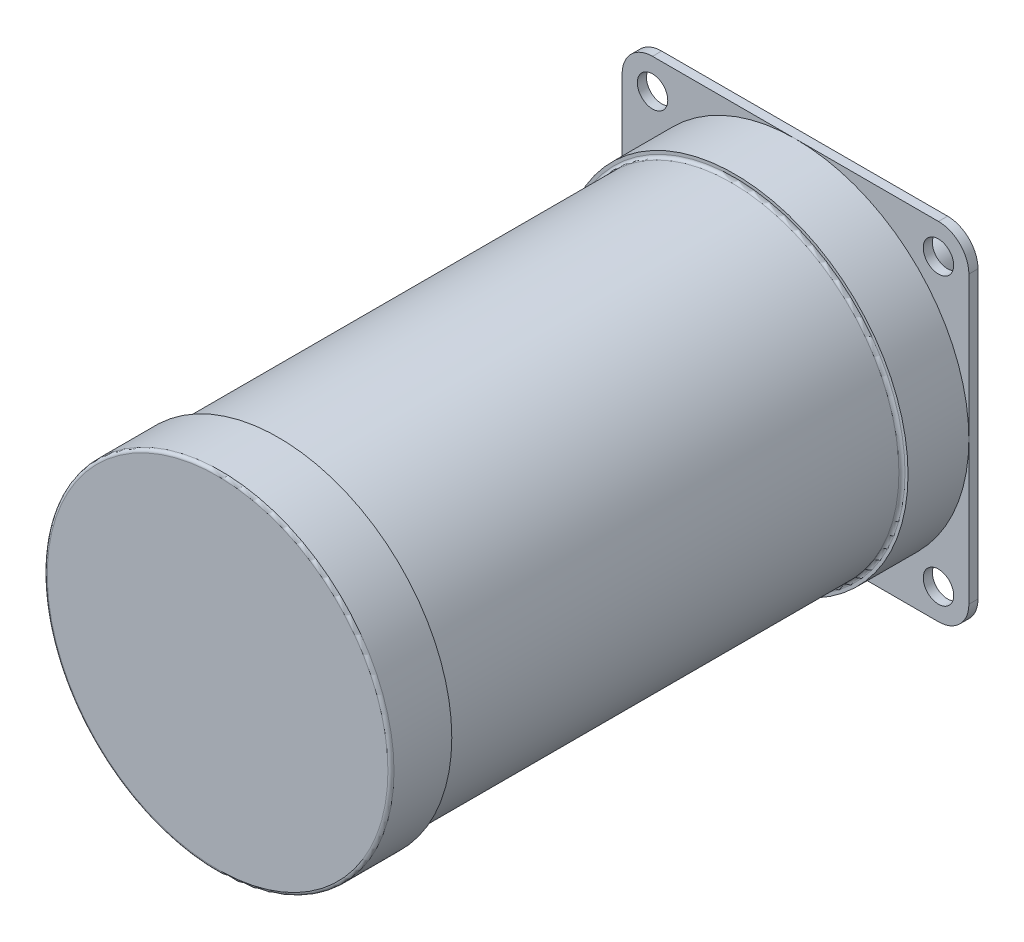
from build123d import *

# Parameters (mm, degrees)
SKETCH1_W           = 57
SKETCH1_H           = 57
BOSS_EXTRUDE1_DEPTH = 1.5
SKETCH2_R           = 28.5
BOSS_EXTRUDE2_DEPTH = 10
SKETCH3_R           = 27.5
BOSS_EXTRUDE3_DEPTH = 75
SKETCH4_R           = 28.5
BOSS_EXTRUDE4_DEPTH = 10
CUT_EXTRUDE1_REACH  = 127.739
SKETCH5_R           = 2.5
SKETCH6_R           = 19
BOSS_EXTRUDE5_DEPTH = 1.5
SKETCH7_R           = 4
BOSS_EXTRUDE6_DEPTH = 20
FILLET1_R           = 5
FILLET2_R           = 0.5


with BuildPart() as part:
    # Sketch1 → Boss-Extrude1 (new body)
    with BuildSketch(Plane.XY):
        with Locations((28.5, 28.5)):
            Rectangle(SKETCH1_W, SKETCH1_H)
    extrude(amount=BOSS_EXTRUDE1_DEPTH)

    # Sketch2 → Boss-Extrude2 (add)
    with BuildSketch(Plane.XY.offset(1.5)):
        with Locations((28.5, 28.5)):
            Circle(SKETCH2_R)
    extrude(amount=BOSS_EXTRUDE2_DEPTH)

    # Sketch3 → Boss-Extrude3 (add)
    with BuildSketch(Plane.XY.offset(11.5)):
        with Locations((28.5, 28.5)):
            Circle(SKETCH3_R)
    extrude(amount=BOSS_EXTRUDE3_DEPTH)

    # Sketch4 → Boss-Extrude4 (add)
    with BuildSketch(Plane.XY.offset(86.5)):
        with Locations((28.5, 28.5)):
            Circle(SKETCH4_R)
    extrude(amount=BOSS_EXTRUDE4_DEPTH)

    # Sketch5 → Cut-Extrude1 (cut, up to next)
    with BuildSketch(Plane(origin=(0, 0, 0), x_dir=(-1, 0, 0), z_dir=(0, 0, -1)), mode=Mode.PRIVATE) as cut_extrude1_sk1:
        with Locations((-52, 52)):
            Circle(SKETCH5_R)
    cut_extrude1_tool1 = extrude(cut_extrude1_sk1.sketch, amount=-CUT_EXTRUDE1_REACH, mode=Mode.PRIVATE) & part.part
    # Sketch5 → Cut-Extrude1 (cut, up to next)
    with BuildSketch(Plane(origin=(0, 0, 0), x_dir=(-1, 0, 0), z_dir=(0, 0, -1)), mode=Mode.PRIVATE) as cut_extrude1_sk2:
        with Locations((-5, 52)):
            Circle(SKETCH5_R)
    cut_extrude1_tool2 = extrude(cut_extrude1_sk2.sketch, amount=-CUT_EXTRUDE1_REACH, mode=Mode.PRIVATE) & part.part
    # Sketch5 → Cut-Extrude1 (cut, up to next)
    with BuildSketch(Plane(origin=(0, 0, 0), x_dir=(-1, 0, 0), z_dir=(0, 0, -1)), mode=Mode.PRIVATE) as cut_extrude1_sk3:
        with Locations((-5, 5)):
            Circle(SKETCH5_R)
    cut_extrude1_tool3 = extrude(cut_extrude1_sk3.sketch, amount=-CUT_EXTRUDE1_REACH, mode=Mode.PRIVATE) & part.part
    # Sketch5 → Cut-Extrude1 (cut, up to next)
    with BuildSketch(Plane(origin=(0, 0, 0), x_dir=(-1, 0, 0), z_dir=(0, 0, -1)), mode=Mode.PRIVATE) as cut_extrude1_sk4:
        with Locations((-52, 5)):
            Circle(SKETCH5_R)
    cut_extrude1_tool4 = extrude(cut_extrude1_sk4.sketch, amount=-CUT_EXTRUDE1_REACH, mode=Mode.PRIVATE) & part.part
    add(cut_extrude1_tool1.solids().sort_by_distance((52, 52, 0))[0], mode=Mode.SUBTRACT)
    add(cut_extrude1_tool2.solids().sort_by_distance((5, 52, 0))[0], mode=Mode.SUBTRACT)
    add(cut_extrude1_tool3.solids().sort_by_distance((5, 5, 0))[0], mode=Mode.SUBTRACT)
    add(cut_extrude1_tool4.solids().sort_by_distance((52, 5, 0))[0], mode=Mode.SUBTRACT)

    # Sketch6 → Boss-Extrude5 (add)
    with BuildSketch(Plane(origin=(0, 0, 0), x_dir=(-1, 0, 0), z_dir=(0, 0, -1))):
        with Locations(Location((-28.5, 28.5, 0), (0, 0, 180))):
            Circle(SKETCH6_R)
    extrude(amount=BOSS_EXTRUDE5_DEPTH)

    # Sketch7 → Boss-Extrude6 (add)
    with BuildSketch(Plane(origin=(0, 0, -1.5), x_dir=(-1, 0, 0), z_dir=(0, 0, -1))):
        with Locations((-28.5, 28.5)):
            Circle(SKETCH7_R)
    extrude(amount=BOSS_EXTRUDE6_DEPTH)

    # Fillet1
    fillet1_edges = [part.edges().sort_by_distance(p)[0] for p in [
        (0, 57, 0.75),
        (57, 57, 0.75),
        (57, 0, 0.75),
        (0, 0, 0.75),
    ]]
    fillet(fillet1_edges, radius=FILLET1_R)

    # Fillet2
    fillet2_edges = [part.edges().sort_by_distance(p)[0] for p in [
        (1, 28.5, 11.5),
        (1, 28.5, 86.5),
        (0, 28.5, 96.5),
        (9.5, 28.5, 0),
        (9.5, 28.5, -1.5),
    ]]
    fillet(fillet2_edges, radius=FILLET2_R)


solid = part.part
